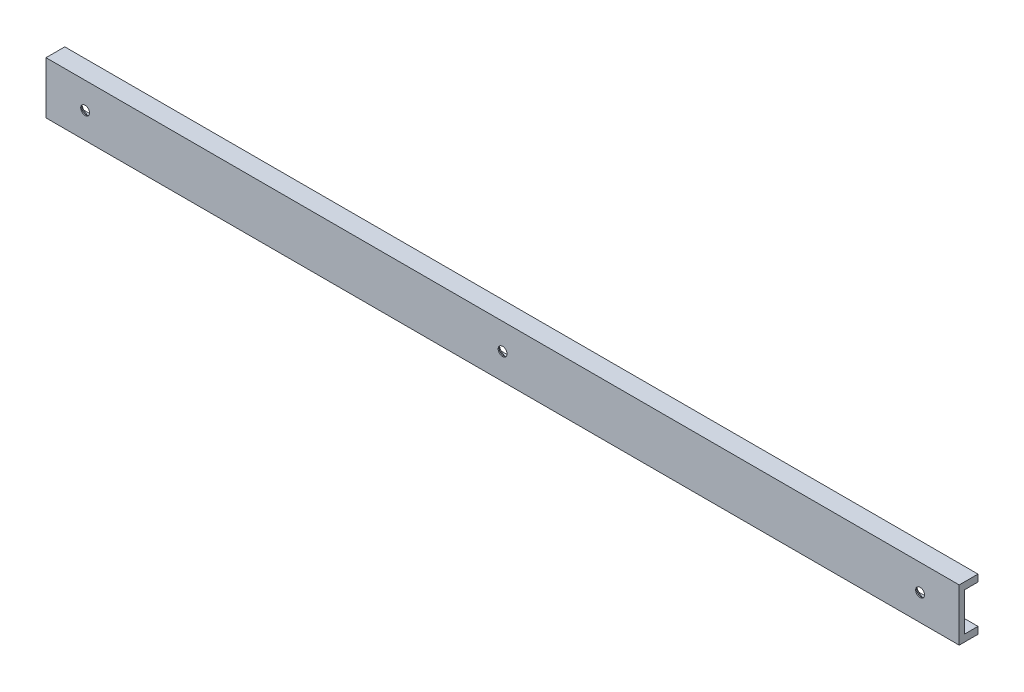
from build123d import *

# Parameters (mm, degrees)
EXTRUDE_1_DEPTH        = 175
PATTERN_LINEAR_1_COUNT = 3
PATTERN_LINEAR_1_PITCH = 160


with BuildPart() as part:
    # 草图1 → 凸台-拉伸1 (new, symmetric)
    with BuildSketch(Plane(origin=(0, 0, 0), x_dir=(0, 0, -1), z_dir=(1, 0, 0))):
        Polygon((0, -10), (0, 10), (7.2, 10), (7.2, 7.35), (2, 7.35), (2, -7.35), (7.2, -7.35), (7.2, -10), align=None)
    extrude(amount=EXTRUDE_1_DEPTH, both=True)

    # 草图5 → M3 开槽半沉头木螺钉的锥形沉头孔1 (revolve, cut)
    with BuildSketch(Plane(origin=(160, 0, -2), x_dir=(0, 1, 0), z_dir=(1, 0, 0))):
        Polygon((0, 0), (0, 2), (1.7, 2), (1.7, 1.6), (3.3, 0), align=None)
    hole_wizard_m3_1 = revolve(axis=Axis((160, 0, -8.35), (0, 0, 1)), mode=Mode.SUBTRACT)

    # 阵列(线性)1: M3 开槽半沉头木螺钉的锥形沉头孔1 ×3
    with Locations(*[(-i * PATTERN_LINEAR_1_PITCH, 0, 0) for i in range(1, PATTERN_LINEAR_1_COUNT)]):
        add(hole_wizard_m3_1, mode=Mode.SUBTRACT)


solid = part.part
